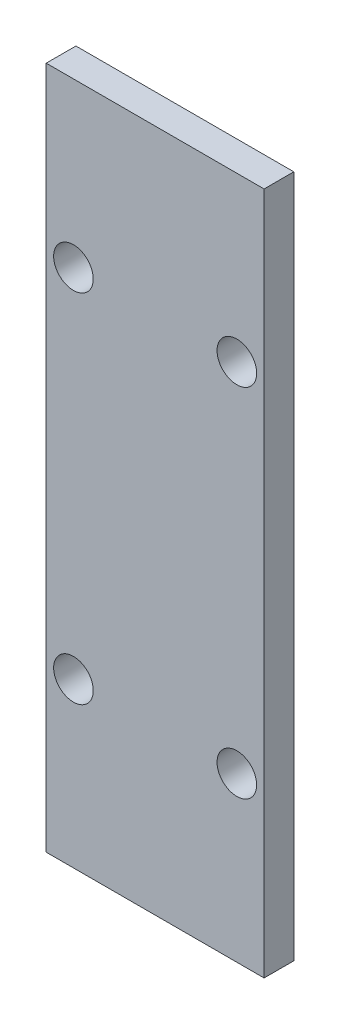
from build123d import *

# Parameters (mm, degrees)
SKETCH_1_W          = 22
SKETCH_1_H          = 69
EXTRUDE_1_DEPTH     = 3
SKETCH_2_R          = 2
CUT_EXTRUDE_1_DEPTH = 37.335244598


with BuildPart() as part:
    # 草图1 → 凸台-拉伸1 (new body)
    with BuildSketch(Plane.XY):
        Rectangle(SKETCH_1_W, SKETCH_1_H)
    extrude(amount=EXTRUDE_1_DEPTH)

    # 草图2 → 切除-拉伸1 (cut, through all)
    with BuildSketch(Plane.XY.offset(3)):
        with Locations((-8.25, 18)):
            Circle(SKETCH_2_R)
        with Locations((8.25, 18)):
            Circle(SKETCH_2_R)
        with Locations((8.25, -18)):
            Circle(SKETCH_2_R)
        with Locations((-8.25, -18)):
            Circle(SKETCH_2_R)
    extrude(amount=-CUT_EXTRUDE_1_DEPTH, mode=Mode.SUBTRACT)


solid = part.part
